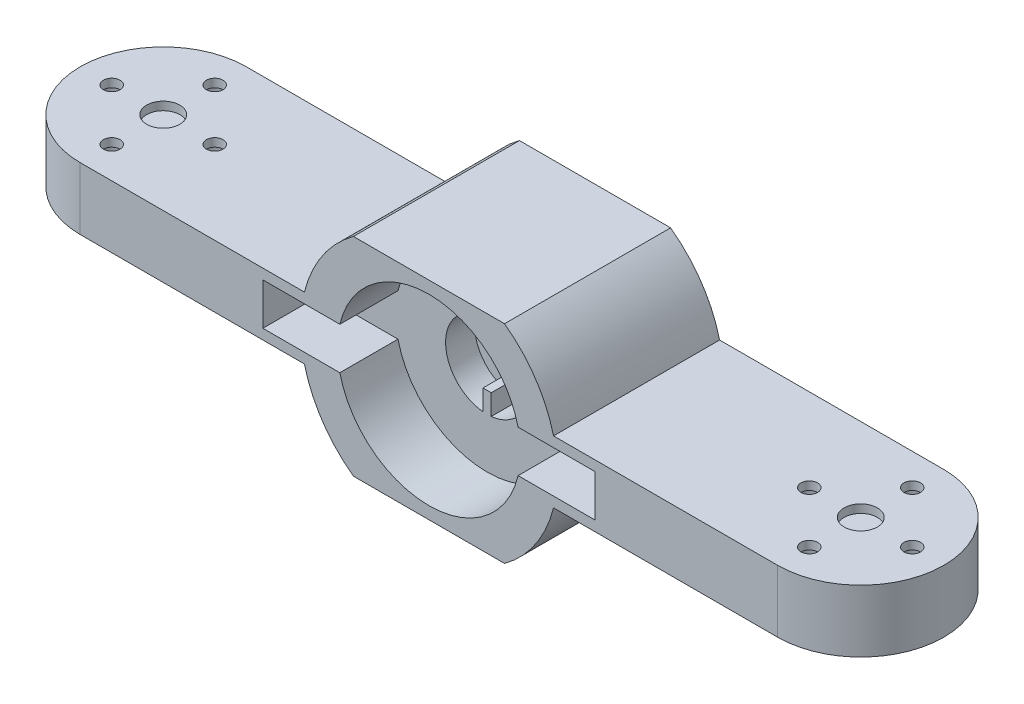
from build123d import *

# Parameters (mm, degrees)
BOSS_EXTRUDE1_DEPTH = 25
SKETCH2_R           = 11.025
CUT_EXTRUDE1_DEPTH  = 7
CUT_EXTRUDE3_DEPTH  = 8.75
CUT_EXTRUDE5_DEPTH  = 8.75
SKETCH5_R           = 1
CUT_EXTRUDE6_DEPTH  = 7.5
SKETCH6_R           = 1.95
CUT_EXTRUDE7_DEPTH  = 6.5
SKETCH7_R           = 2
CUT_EXTRUDE8_DEPTH  = 1
CUT_EXTRUDE9_DEPTH  = 62.065538563
CUT_EXTRUDE10_DEPTH = 3.5
SKETCH10_W          = 40
SKETCH10_H          = 5.05
CUT_EXTRUDE11_DEPTH = 7


with BuildPart() as part:
    # Sketch1 → Boss-Extrude1 (new body)
    with BuildSketch(Plane(origin=(0, 0, 0), x_dir=(1, 0, 0), z_dir=(0, 1, 0))):
        with BuildLine():
            Line((-42, -10), (42, -10))
            ThreePointArc((42, -10), (52, 0), (42, 10))
            Line((42, 10), (-42, 10))
            ThreePointArc((-42, 10), (-52, 0), (-42, -10))
        make_face()
    extrude(amount=BOSS_EXTRUDE1_DEPTH)

    # Sketch2 → Cut-Extrude1 (cut)
    with BuildSketch(Plane.XY.offset(10)):
        with Locations((0, 12.5)):
            Circle(SKETCH2_R)
    extrude(amount=-CUT_EXTRUDE1_DEPTH, mode=Mode.SUBTRACT)

    # Sketch3 → Cut-Extrude3 (cut)
    with BuildSketch(Plane.XZ):
        with BuildLine():
            Line((15, -10), (15, 10))
            Line((15, 10), (42, 10))
            ThreePointArc((42, 10), (52, 0), (42, -10))
            Line((42, -10), (15, -10))
        make_face()
        with BuildLine():
            Line((-15, -10), (-15, 10))
            Line((-15, 10), (-42, 10))
            ThreePointArc((-42, 10), (-52, 0), (-42, -10))
            Line((-42, -10), (-15, -10))
        make_face()
    extrude(amount=-CUT_EXTRUDE3_DEPTH, mode=Mode.SUBTRACT)

    # Sketch4 → Cut-Extrude5 (cut)
    with BuildSketch(Plane(origin=(0, 25, 0), x_dir=(1, 0, 0), z_dir=(0, 1, 0))):
        with BuildLine():
            Line((15, -10), (15, 10))
            Line((15, 10), (55, 10))
            ThreePointArc((55, 10), (65, 0), (55, -10))
            Line((55, -10), (15, -10))
        make_face()
        with BuildLine():
            Line((-15, -10), (-15, 10))
            Line((-15, 10), (-55, 10))
            ThreePointArc((-55, 10), (-65, 0), (-55, -10))
            Line((-55, -10), (-15, -10))
        make_face()
    extrude(amount=-CUT_EXTRUDE5_DEPTH, mode=Mode.SUBTRACT)

    # Sketch5 → Cut-Extrude6 (cut)
    with BuildSketch(Plane(origin=(0, 16.25, 0), x_dir=(1, 0, 0), z_dir=(0, 1, 0))):
        with Locations(Location((-42, 6.2, 0), (0, 0, 270))):
            Circle(SKETCH5_R)
        with Locations(Location((-35.8, 0, 0), (0, 0, 270))):
            Circle(SKETCH5_R)
        with Locations(Location((-42, -6.2, 0), (0, 0, 270))):
            Circle(SKETCH5_R)
        with Locations(Location((-48.2, 0, 0), (0, 0, 270))):
            Circle(SKETCH5_R)
        with Locations(Location((42, 6.2, 0), (0, 0, 270))):
            Circle(SKETCH5_R)
        with Locations(Location((48.2, 0, 0), (0, 0, 270))):
            Circle(SKETCH5_R)
        with Locations(Location((42, -6.2, 0), (0, 0, 270))):
            Circle(SKETCH5_R)
        with Locations(Location((35.8, 0, 0), (0, 0, 270))):
            Circle(SKETCH5_R)
    extrude(amount=-CUT_EXTRUDE6_DEPTH, mode=Mode.SUBTRACT)

    # Sketch6 → Cut-Extrude7 (cut)
    with BuildSketch(Plane.XZ.offset(-8.75)):
        with Locations(Location((-42, 6.2, 0), (0, 0, 270))):
            Circle(SKETCH6_R)
        with Locations(Location((-35.8, 0, 0), (0, 0, 270))):
            Circle(SKETCH6_R)
        with Locations(Location((-48.2, 0, 0), (0, 0, 270))):
            Circle(SKETCH6_R)
        with Locations(Location((-42, -6.2, 0), (0, 0, 270))):
            Circle(SKETCH6_R)
        with Locations(Location((42, 6.2, 0), (0, 0, 270))):
            Circle(SKETCH6_R)
        with Locations(Location((48.2, 0, 0), (0, 0, 270))):
            Circle(SKETCH6_R)
        with Locations(Location((35.8, 0, 0), (0, 0, 270))):
            Circle(SKETCH6_R)
        with Locations(Location((42, -6.2, 0), (0, 0, 270))):
            Circle(SKETCH6_R)
    extrude(amount=-CUT_EXTRUDE7_DEPTH, mode=Mode.SUBTRACT)

    # Sketch7 → Cut-Extrude8 (cut)
    with BuildSketch(Plane(origin=(0, 16.25, 0), x_dir=(1, 0, 0), z_dir=(0, 1, 0))):
        with Locations(Location((-42, 0, 0), (0, 0, 270))):
            Circle(SKETCH7_R)
        with Locations(Location((42, 0, 0), (0, 0, 270))):
            Circle(SKETCH7_R)
    extrude(amount=-CUT_EXTRUDE8_DEPTH, mode=Mode.SUBTRACT)

    # Sketch8 → Cut-Extrude9 (cut, through all)
    with BuildSketch(Plane.XY.offset(10)):
        with BuildLine():
            Line((-15, 16.25), (-15, 25))
            Line((-15, 25), (-9.100137362, 25))
            ThreePointArc((-9.100137362, 25), (-12.819702813, 21.143941218), (-15, 16.25))
        make_face()
        with BuildLine():
            Line((15, 0), (9.100137362, 0))
            ThreePointArc((9.100137362, 0), (12.819702813, 3.856058782), (15, 8.75))
            Line((15, 8.75), (15, 0))
        make_face()
        with BuildLine():
            Line((15, 25), (9.100137362, 25))
            ThreePointArc((9.100137362, 25), (12.819702813, 21.143941218), (15, 16.25))
            Line((15, 16.25), (15, 25))
        make_face()
        with BuildLine():
            Line((-15, 0), (-15, 8.75))
            ThreePointArc((-15, 8.75), (-12.819702813, 3.856058782), (-9.100137362, 0))
            Line((-9.100137362, 0), (-15, 0))
        make_face()
    extrude(amount=-CUT_EXTRUDE9_DEPTH, mode=Mode.SUBTRACT)

    # Sketch9 → Cut-Extrude10 (cut)
    with BuildSketch(Plane.XY.offset(3)):
        with BuildLine():
            Line((0.5, 10), (0.5, 7.525062814))
            ThreePointArc((0.5, 7.525062814), (5, 12.5), (0.5, 17.474937186))
            Line((0.5, 17.474937186), (0.5, 15))
            Line((0.5, 15), (-0.5, 15))
            Line((-0.5, 15), (-0.5, 17.474937186))
            ThreePointArc((-0.5, 17.474937186), (-5, 12.5), (-0.5, 7.525062814))
            Line((-0.5, 7.525062814), (-0.5, 10))
            Line((-0.5, 10), (0.5, 10))
        make_face()
    extrude(amount=-CUT_EXTRUDE10_DEPTH, mode=Mode.SUBTRACT)

    # Sketch10 → Cut-Extrude11 (cut)
    with BuildSketch(Plane.XY.offset(10)):
        with Locations((0, 12.5)):
            Rectangle(SKETCH10_W, SKETCH10_H)
    extrude(amount=-CUT_EXTRUDE11_DEPTH, mode=Mode.SUBTRACT)


solid = part.part
